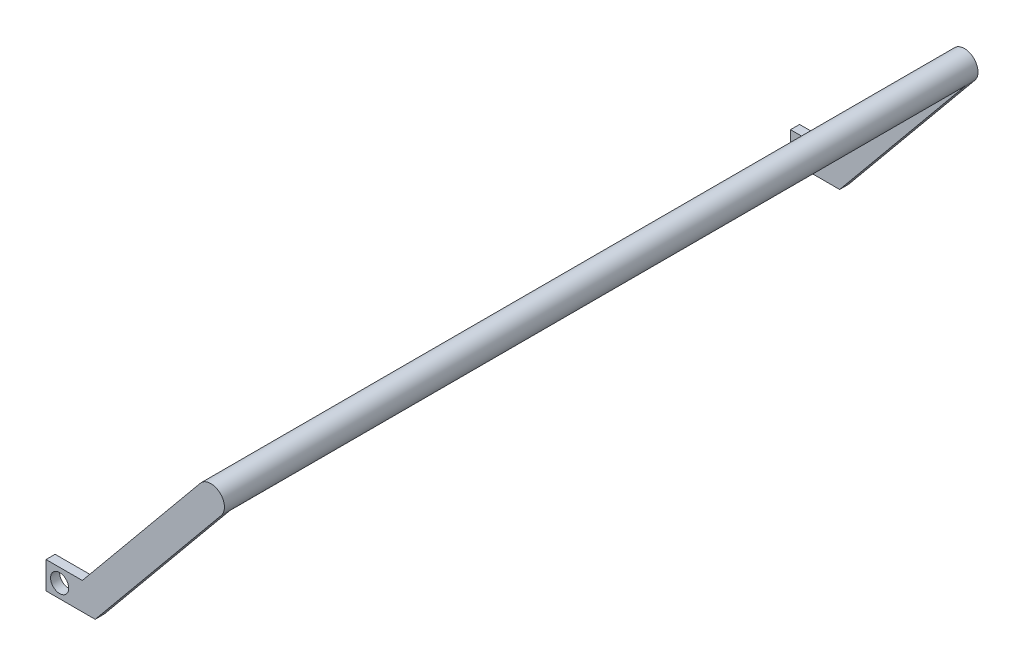
from build123d import *
from build123d.topology import SkipClean

# Parameters (mm, degrees)
BOSS_EXTRUDE1_DEPTH     = 5
SKETCH2_R               = 7.5
BOSS_EXTRUDE2_DEPTH     = 410
BOSS_EXTRUDE3_DEPTH     = 5
SKETCH4_R               = 7.5
BOSS_EXTRUDE4_DEPTH     = 5
CUT_EXTRUDE1_DEPTH      = 435.21341148
CUT_EXTRUDE1_DEPTH_BACK = 435.21341148
SKETCH5_R               = 5


with BuildPart() as part:
    # Sketch1 → Boss-Extrude1 (new body)
    with BuildSketch(Plane.XY):
        Polygon((0, 0), (20, 0), (84.986314287, 78.868447374), (96.562686745, 69.329705281), (27.076385016, -15), (0, -15), align=None)
    extrude(amount=-BOSS_EXTRUDE1_DEPTH)

    # Sketch2 → Boss-Extrude2 (add)
    with BuildSketch(Plane.XY):
        with Locations((90.774500516, 74.099076328)):
            Circle(SKETCH2_R)
    extrude(amount=-BOSS_EXTRUDE2_DEPTH)



with BuildPart() as body_2:
    # Sketch3 → Boss-Extrude3 (new body)
    with BuildSketch(Plane(origin=(0, 0, -410), x_dir=(-1, 0, 0), z_dir=(0, 0, -1))):
        with BuildLine():
            Line((-20, 0), (-84.986314287, 78.868447374))
            ThreePointArc((-84.986314287, 78.868447374), (-86.005129469, 68.310890099), (-96.562686745, 69.329705281))
            Line((-96.562686745, 69.329705281), (-27.076385016, -15))
            Line((-27.076385016, -15), (0, -15))
            Line((0, -15), (0, 0))
            Line((0, 0), (-20, 0))
        make_face()
    extrude(amount=BOSS_EXTRUDE3_DEPTH)


with BuildPart() as part_1:
    with SkipClean():  # the faces are left unmerged after this step: merging them gives an invalid solid
        add(part.part)

        add(body_2.part)  # Boss-Extrude4 merges body 2
        # Sketch4 → Boss-Extrude4 (add)
        with BuildSketch(Plane(origin=(0, 0, -410), x_dir=(-1, 0, 0), z_dir=(0, 0, -1))):
            with Locations(Location((-90.774500516, 74.099076328, 0), (0, 0, 219.487965992))):
                Circle(SKETCH4_R)
        extrude(amount=BOSS_EXTRUDE4_DEPTH)

    # Sketch5 → Cut-Extrude1 (cut, two sides: drawn at the far end of the back side and taken through both)
    with SkipClean():  # the faces are left unmerged after this step: merging them gives an invalid solid
        with BuildSketch(Plane(origin=(0, 0, -415), x_dir=(-1, 0, 0), z_dir=(0, 0, -1)).offset(-CUT_EXTRUDE1_DEPTH_BACK)):
            with Locations((-7.5, -7.5)):
                Circle(SKETCH5_R)
        extrude(amount=CUT_EXTRUDE1_DEPTH + CUT_EXTRUDE1_DEPTH_BACK, mode=Mode.SUBTRACT)


solid = part_1.part
